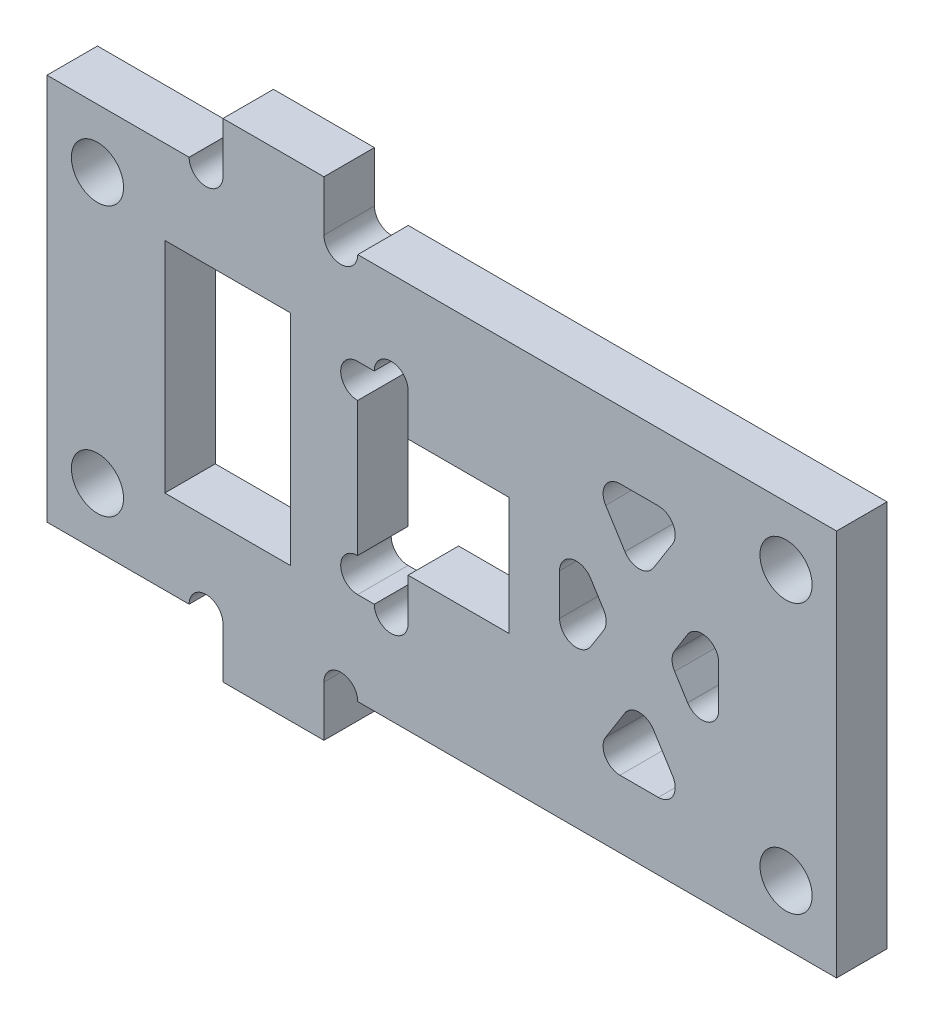
from build123d import *

# Parameters (mm, degrees)
SKETCH_1_R      = 1.55
SKETCH_1_W      = 7.455
SKETCH_1_H      = 13
EXTRUDE_1_DEPTH = 3
FILLET_1_R      = 1


with BuildPart() as part:
    # 草图1 → 凸台-拉伸1 (new body)
    with BuildSketch(Plane.XY):
        with BuildLine():
            Line((-13, 14.5), (-13, 11.5))
            ThreePointArc((-13, 11.5), (-14.005, 10.495), (-15.01, 11.5))
            Line((-15.01, 11.5), (-23.455, 11.5))
            Line((-23.455, 11.5), (-23.455, -11.5))
            Line((-23.455, -11.5), (-15.01, -11.5))
            ThreePointArc((-15.01, -11.5), (-14.005, -10.495), (-13, -11.5))
            Line((-13, -11.5), (-13, -14.5))
            Line((-13, -14.5), (-7, -14.5))
            Line((-7, -14.5), (-7, -11.5))
            ThreePointArc((-7, -11.5), (-5.995, -10.495), (-4.99, -11.5))
            Line((-4.99, -11.5), (23.455, -11.5))
            Line((23.455, -11.5), (23.455, 11.5))
            Line((23.455, 11.5), (-4.99, 11.5))
            ThreePointArc((-4.99, 11.5), (-5.995, 10.495), (-7, 11.5))
            Line((-7, 11.5), (-7, 14.5))
            Line((-7, 14.5), (-13, 14.5))
        make_face()
        with Locations((-20.455, -8)):
            Circle(SKETCH_1_R, mode=Mode.SUBTRACT)
        with Locations((20.455, -8)):
            Circle(SKETCH_1_R, mode=Mode.SUBTRACT)
        Polygon((9.954375568, 0), (7, -4.687005132), (7, 4.687005132), align=None, mode=Mode.SUBTRACT)
        Polygon((11.7275, -2.812994868), (14.681875568, -7.5), (8.773124432, -7.5), align=None, mode=Mode.SUBTRACT)
        with Locations((-12.7275, 0)):
            Rectangle(SKETCH_1_W, SKETCH_1_H, mode=Mode.SUBTRACT)
        with BuildLine():
            Line((-2, -3.5), (-2, -6))
            ThreePointArc((-2, -6), (-3.005, -7.005), (-4.01, -6))
            Line((-4.01, -6), (-5, -6))
            ThreePointArc((-5, -6), (-6.005, -4.995), (-5, -3.99))
            Line((-5, -3.99), (-5, 3.99))
            ThreePointArc((-5, 3.99), (-6.005, 4.995), (-5, 6))
            Line((-5, 6), (-4.01, 6))
            ThreePointArc((-4.01, 6), (-3.005, 7.005), (-2, 6))
            Line((-2, 6), (-2, 3.5))
            Line((-2, 3.5), (4, 3.5))
            Line((4, 3.5), (4, -3.5))
            Line((4, -3.5), (-2, -3.5))
        make_face(mode=Mode.SUBTRACT)
        with Locations((-20.455, 8)):
            Circle(SKETCH_1_R, mode=Mode.SUBTRACT)
        Polygon((16.455, 4.687005132), (16.455, -4.687005132), (13.500624432, 0), align=None, mode=Mode.SUBTRACT)
        Polygon((11.7275, 2.812994868), (8.773124432, 7.5), (14.681875568, 7.5), align=None, mode=Mode.SUBTRACT)
        with Locations((20.455, 8)):
            Circle(SKETCH_1_R, mode=Mode.SUBTRACT)
    extrude(amount=EXTRUDE_1_DEPTH)

    # 圆角1
    fillet_1_edges = [part.edges().sort_by_distance(p)[0] for p in [
        (16.455, -4.687005132, 1.5),
        (16.455, 4.687005132, 1.5),
        (13.500624432, 0, 1.5),
        (14.681875568, -7.5, 1.5),
        (11.7275, -2.812994868, 1.5),
        (8.773124432, -7.5, 1.5),
        (7, 4.687005132, 1.5),
        (7, -4.687005132, 1.5),
        (9.954375568, 0, 1.5),
        (14.681875568, 7.5, 1.5),
        (8.773124432, 7.5, 1.5),
        (11.7275, 2.812994868, 1.5),
    ]]
    fillet(fillet_1_edges, radius=FILLET_1_R)


solid = part.part
